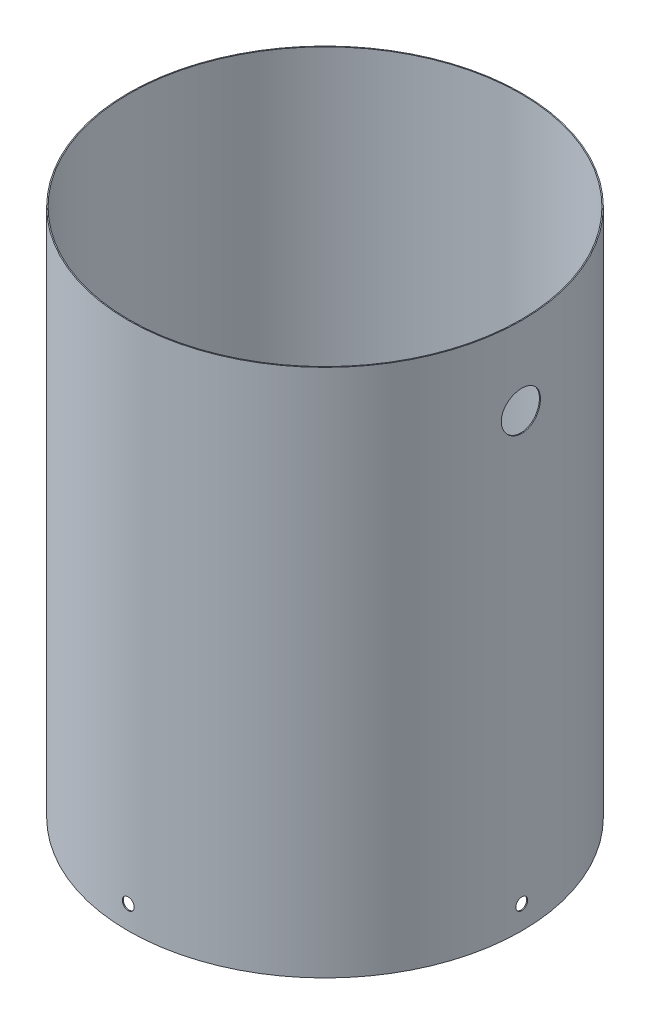
from build123d import *

# Parameters (mm, degrees)
SKETCH_1_R               = 100.5
SKETCH_1_R_2             = 100
EXTRUDE_1_DEPTH          = 270
CUT_EXTRUDE_1_DEPTH      = 306.123745389
CUT_EXTRUDE_1_DEPTH_BACK = 306.123745389
SKETCH_3_R               = 3.02
CUT_EXTRUDE_2_REACH      = 307.124
SKETCH_3_3_R             = 10
CUT_EXTRUDE_3_DEPTH      = 306.123745543
CUT_EXTRUDE_3_DEPTH_BACK = 306.123745543
SKETCH_6_R               = 3.02


with BuildPart() as part:
    # 草图1 → 拉伸-薄壁1 (new body)
    with BuildSketch(Plane(origin=(0, 0, 0), x_dir=(1, 0, 0), z_dir=(0, 1, 0))):
        Circle(SKETCH_1_R)
        Circle(SKETCH_1_R_2, mode=Mode.SUBTRACT)
    extrude(amount=EXTRUDE_1_DEPTH)

    # 草图3 → 切除-拉伸1 (cut, two sides: drawn at the far end of the back side and taken through both)
    with BuildSketch(Plane(origin=(0, 0, 0), x_dir=(0, 0, -1), z_dir=(1, 0, 0)).offset(-CUT_EXTRUDE_1_DEPTH_BACK)):
        with Locations((0, 12)):
            Circle(SKETCH_3_R)
    extrude(amount=CUT_EXTRUDE_1_DEPTH + CUT_EXTRUDE_1_DEPTH_BACK, mode=Mode.SUBTRACT)

    # 草图3<3> → 切除-拉伸2 (cut, up to next)
    with BuildSketch(Plane(origin=(0, 0, 0), x_dir=(0, 0, -1), z_dir=(1, 0, 0)), mode=Mode.PRIVATE) as cut_extrude_2_sk1:
        with Locations((0, 230)):
            Circle(SKETCH_3_3_R)
    cut_extrude_2_tool1 = extrude(cut_extrude_2_sk1.sketch, amount=CUT_EXTRUDE_2_REACH, mode=Mode.PRIVATE) & part.part
    add(cut_extrude_2_tool1.solids().sort_by_distance((0, 230, 0))[0], mode=Mode.SUBTRACT)

    # 草图6 → 切除-拉伸3 (cut, two sides: drawn at the far end of the back side and taken through both)
    with BuildSketch(Plane.XY.offset(-CUT_EXTRUDE_3_DEPTH_BACK)):
        with Locations((0, 12)):
            Circle(SKETCH_6_R)
    extrude(amount=CUT_EXTRUDE_3_DEPTH + CUT_EXTRUDE_3_DEPTH_BACK, mode=Mode.SUBTRACT)


solid = part.part
